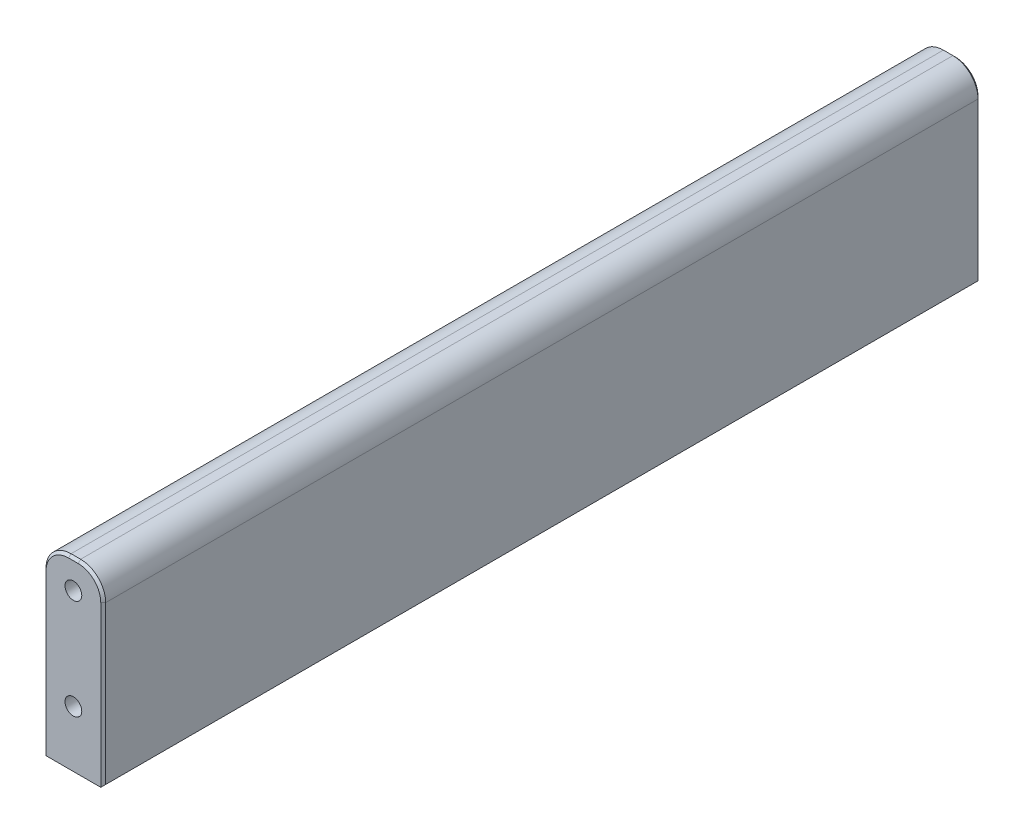
from build123d import *

# Parameters (mm, degrees)
SKETCH1_R           = 1.7
BOSS_EXTRUDE1_DEPTH = 177.8
CHAMFER1_SIZE       = 0.5


with BuildPart() as part:
    # Sketch1 → Boss-Extrude1 (new body)
    with BuildSketch(Plane.XY):
        with BuildLine():
            Line((-0.97, 18.75), (0.97, 18.75))
            ThreePointArc((0.97, 18.75), (4.562102448, 17.262102448), (6.05, 13.67))
            Line((6.05, 13.67), (6.05, -18.75))
            Line((6.05, -18.75), (-6.05, -18.75))
            Line((-6.05, -18.75), (-6.05, 13.67))
            ThreePointArc((-6.05, 13.67), (-4.562102448, 17.262102448), (-0.97, 18.75))
        make_face()
        with Locations((0, 13)):
            Circle(SKETCH1_R, mode=Mode.SUBTRACT)
        with Locations((0, -7.32)):
            Circle(SKETCH1_R, mode=Mode.SUBTRACT)
    extrude(amount=BOSS_EXTRUDE1_DEPTH)

    # Chamfer1
    chamfer1_edges = [part.edges().sort_by_distance(p)[0] for p in [
        (6.05, -18.75, 88.9),
        (-6.05, -18.75, 88.9),
        (0, 18.75, 177.8),
        (-4.562102448, 17.262102448, 177.8),
        (-6.05, -2.54, 177.8),
        (6.05, -2.54, 177.8),
        (-6.05, -2.54, 0),
        (-4.562102448, 17.262102448, 0),
        (0, 18.75, 0),
        (4.562102448, 17.262102448, 0),
        (6.05, -2.54, 0),
        (4.562102448, 17.262102448, 177.8),
    ]]
    chamfer(chamfer1_edges, length=CHAMFER1_SIZE)


solid = part.part
